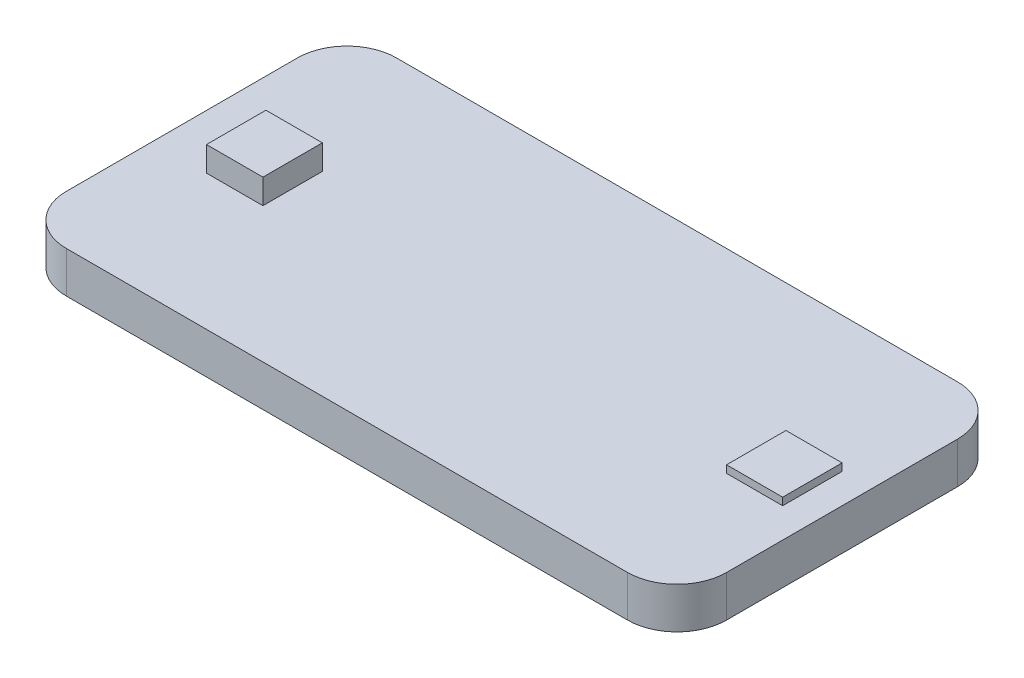
from build123d import *

# Parameters (mm, degrees)
SKETCH1_W           = 800
SKETCH1_H           = 400
BOSS_EXTRUDE1_DEPTH = 50
FILLET1_R           = 60
SKETCH3_W           = 68.405794472
SKETCH3_H           = 72.041840608
BOSS_EXTRUDE2_DEPTH = 30
SKETCH5_W           = 68
SKETCH5_H           = 72
BOSS_EXTRUDE3_DEPTH = 9


with BuildPart() as part:
    # Sketch1 → Boss-Extrude1 (new body)
    with BuildSketch(Plane(origin=(0, 0, 0), x_dir=(1, 0, 0), z_dir=(0, 1, 0))):
        Rectangle(SKETCH1_W, SKETCH1_H)
    extrude(amount=BOSS_EXTRUDE1_DEPTH)

    # Fillet1
    fillet1_edges = [part.edges().sort_by_distance(p)[0] for p in [
        (400, 25, 200),
        (-400, 25, 200),
        (-400, 25, -200),
        (400, 25, -200),
    ]]
    fillet(fillet1_edges, radius=FILLET1_R)

    # Sketch3 → Boss-Extrude2 (add)
    with BuildSketch(Plane(origin=(0, 50, 0), x_dir=(1, 0, 0), z_dir=(0, 1, 0))):
        with Locations((-300, 0)):
            Rectangle(SKETCH3_W, SKETCH3_H)
    extrude(amount=BOSS_EXTRUDE2_DEPTH)

    # Sketch5 → Boss-Extrude3 (add)
    with BuildSketch(Plane(origin=(0, 50, 0), x_dir=(1, 0, 0), z_dir=(0, 1, 0))):
        with Locations((330, 0)):
            Rectangle(SKETCH5_W, SKETCH5_H)
    extrude(amount=BOSS_EXTRUDE3_DEPTH)


solid = part.part
